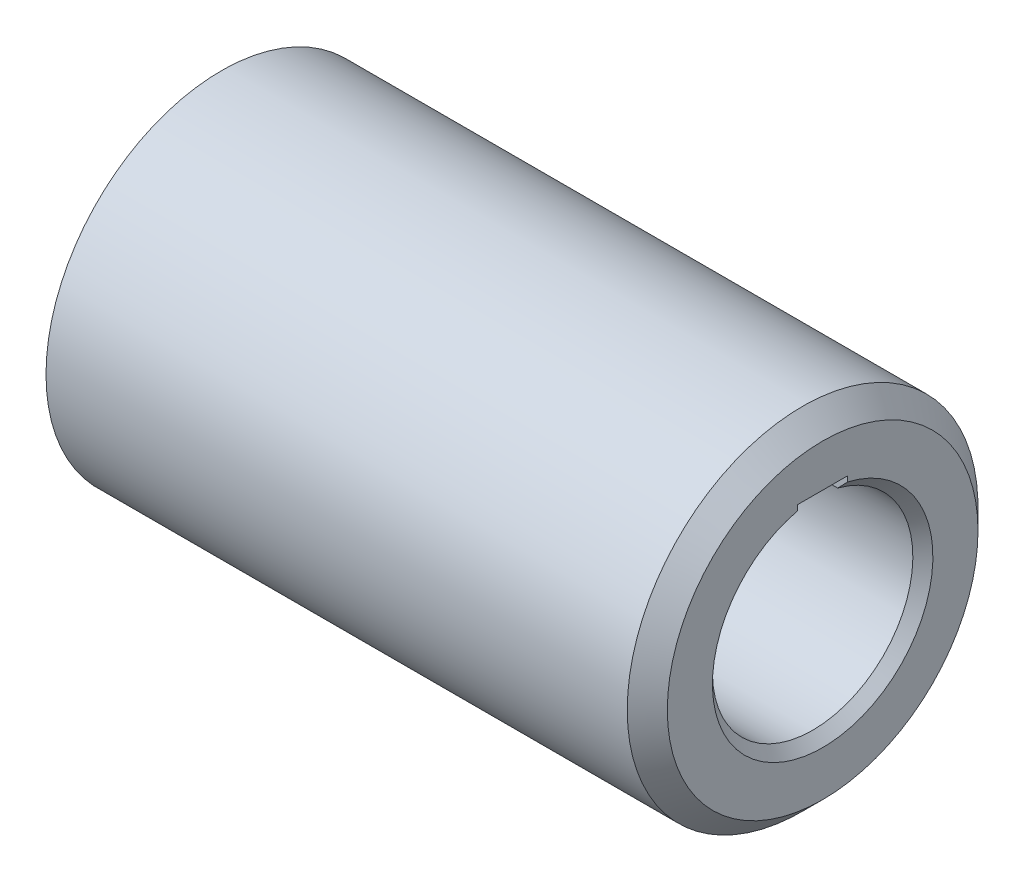
from build123d import *

# Parameters (mm, degrees)
SKETCH1_R           = 11.1125
BOSS_EXTRUDE1_DEPTH = 38.1
SKETCH2_R           = 6.35
CUT_EXTRUDE1_DEPTH  = 25.4
SKETCH3_W           = 3.175
SKETCH3_H           = 1.5875
CUT_EXTRUDE2_DEPTH  = 25.4
CHAMFER2_SIZE       = 0.635
CHAMFER3_SIZE       = 1.27


with BuildPart() as part:
    # Sketch1 → Boss-Extrude1 (new body)
    with BuildSketch(Plane(origin=(0, 0, 0), x_dir=(0, 0, -1), z_dir=(1, 0, 0))):
        with Locations(Location((0, 0, 0), (0, 0, 180))):
            Circle(SKETCH1_R)
    extrude(amount=BOSS_EXTRUDE1_DEPTH)

    # Sketch2 → Cut-Extrude1 (cut)
    with BuildSketch(Plane(origin=(38.1, 0, 0), x_dir=(0, 0, -1), z_dir=(1, 0, 0))):
        Circle(SKETCH2_R)
    extrude(amount=-CUT_EXTRUDE1_DEPTH, mode=Mode.SUBTRACT)

    # Sketch3 → Cut-Extrude2 (cut)
    with BuildSketch(Plane(origin=(38.1, 0, 0), x_dir=(0, 0, -1), z_dir=(1, 0, 0))):
        with Locations((0, 6.35)):
            Rectangle(SKETCH3_W, SKETCH3_H)
    extrude(amount=-CUT_EXTRUDE2_DEPTH, mode=Mode.SUBTRACT)

    # Chamfer2
    chamfer2_edges = [part.edges().sort_by_distance(p)[0] for p in [
        (38.1, -6.35, 0),
    ]]
    chamfer(chamfer2_edges, length=CHAMFER2_SIZE)

    # Chamfer3
    chamfer3_edges = [part.edges().sort_by_distance(p)[0] for p in [
        (38.1, 0, -11.1125),
    ]]
    chamfer(chamfer3_edges, length=CHAMFER3_SIZE)


solid = part.part
